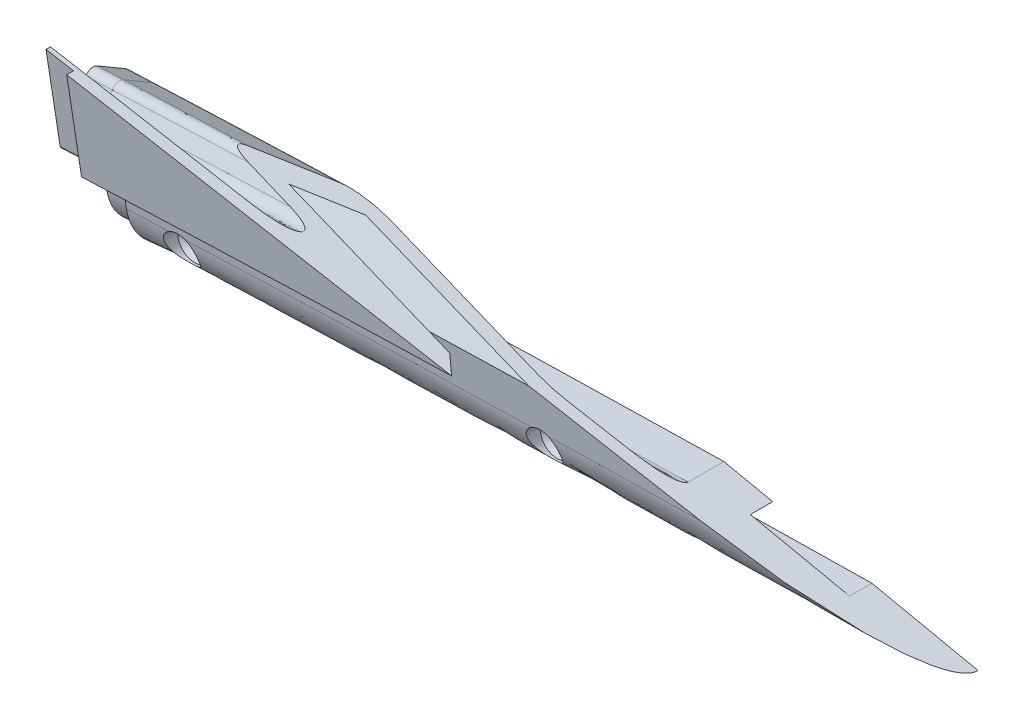
from build123d import *


with BuildPart() as part:
    # Sweep3: sweep along a path in Sketch3
    with BuildLine(Plane.XY.offset(101.6)) as sweep3_path:
        ThreePointArc((622.103936151, -83.199836272), (0, -43.636564626), (-622.103936151, -83.199836272))
    # Sketch4 → Sweep3 (sweep)
    with BuildSketch(Plane(origin=(-117.330566703, 4.430423936, 1117.6), x_dir=(0, 0, -1), z_dir=(0.9994536405585157, 0.03305178322465143, 0))):
        with BuildLine():
            Line((991.529482971, -5.453775083), (988.971801376, -5.453775083))
            Line((988.971801376, -5.453775083), (993.32506615, -42.283775083))
            Line((993.32506615, -42.283775083), (996.794703229, -41.354088728))
            Line((996.794703229, -41.354088728), (1002.763703229, -31.015013775))
            Line((1002.763703229, -31.015013775), (1007.999, -34.037749136))
            Line((1007.999, -34.037749136), (1002.03, -44.376824659))
            Line((1002.03, -44.376824659), (1003.077032208, -53.235049058))
            ThreePointArc((1003.077032208, -53.235049058), (1007.29752688, -61.276835992), (1015.8095, -64.443731312))
            Line((1015.8095, -64.443731312), (1015.8095, -59.12218153))
            Line((1015.8095, -59.12218153), (1010.7295, -59.12218153))
            Line((1010.7295, -59.12218153), (1010.7295, -54.041969025))
            Line((1010.7295, -54.041969025), (1015.8095, -54.041969025))
            Line((1015.8095, -54.041969025), (1015.8095, -51.501969025))
            Line((1015.8095, -51.501969025), (1007.687322123, -51.501969025))
            ThreePointArc((1007.687322123, -51.501969025), (1005.99997215, -50.860507955), (1005.164881483, -49.260118685))
            Line((1005.164881483, -49.260118685), (1004.750455768, -45.75394576))
            ThreePointArc((1004.750455768, -45.75394576), (1004.7850335, -44.943801809), (1005.073167189, -44.18583887))
            Line((1005.073167189, -44.18583887), (1010.516206197, -34.757795418))
            ThreePointArc((1010.516206197, -34.757795418), (1010.706497969, -33.312277166), (1009.818941274, -32.155567572))
            Line((1009.818941274, -32.155567572), (1003.483804566, -28.49781089))
            ThreePointArc((1003.483804566, -28.49781089), (1002.038222268, -28.307482122), (1000.881475684, -29.195102853))
            Line((1000.881475684, -29.195102853), (999.272416391, -31.982200293))
            ThreePointArc((999.272416391, -31.982200293), (996.560692883, -33.200105913), (994.550246564, -31.010392672))
            Line((994.550246564, -31.010392672), (991.529482971, -5.453775083))
        make_face()
    sweep(path=sweep3_path.line)

    # SurfaceCut1
    split(bisect_by=Plane(origin=(-211.442164364, -9.040193423, 0), x_dir=(0.04271589869142412, -0.9990872594518379, 0), z_dir=(-0.9990872594518379, -0.04271589869142412, 0)), keep=Keep.BOTTOM)

    # SurfaceCut2
    split(bisect_by=Plane(origin=(-22.670567211, -0.103737371, 0), x_dir=(-0.004575813400742646, 0.9999895309110599, 0), z_dir=(0.99998953091106, 0.004575813400742646, 0)), keep=Keep.BOTTOM)

    # Sketch8 → Cut-Revolve1 (revolve, cut)
    with BuildSketch(Plane(origin=(-117.056038996, -3.871025798, 0), x_dir=(0, 0, -1), z_dir=(0.9994536405585157, 0.03305178322465143, 0)), mode=Mode.PRIVATE) as cut_revolve1_sk:
        Polygon((-119.5705, -48.27608749), (-106.8705, -48.27608749), (-106.8705, -46.37108749), (-108.7755, -46.37108749), (-110.6805, -44.46608749), (-119.5705, -44.46608749), align=None)
    cut_revolve1 = revolve(cut_revolve1_sk.sketch.rotate(Axis((-115.460428217, -52.120737191, 119.5705), (0, 0, -1)), 91.894072645), axis=Axis((-115.460428217, -52.120737191, 119.5705), (0, 0, -1)), mode=Mode.SUBTRACT)

    # Sketch-Pattern1: Cut-Revolve1 at 2 more places
    with Locations((82.543476, 1.248991, 0), (-82.510753, -2.638363, 0)):
        add(cut_revolve1, mode=Mode.SUBTRACT)

    # Sweep4: sweep along a path in Sketch12
    with BuildLine(Plane(origin=(0, 0, 101.7905), x_dir=(-1, 0, 0), z_dir=(0, 0, -1))) as sweep4_path:
        ThreePointArc((22.461775047, -45.732778631), (19.477278647, -45.720029285), (16.492775047, -45.709094497))
    # Sketch11 → Sweep4 (sweep)
    with BuildSketch(Plane(origin=(-22.670567211, -0.103737371, 0), x_dir=(0, 0, -1), z_dir=(0.9999895309110599, 0.004575813400742645, 0))):
        with BuildLine():
            Line((-127.477241199, 0.416616241), (-123.294888708, -34.965832659))
            Line((-123.294888708, -34.965832659), (-121.558436986, -34.500572786))
            Line((-121.558436986, -34.500572786), (-115.572163807, -24.132043494))
            ThreePointArc((-115.572163807, -24.132043494), (-115.18658777, -23.836180594), (-114.704737676, -23.899617362))
            Line((-114.704737676, -23.899617362), (-108.589559095, -27.430217362))
            ThreePointArc((-108.589559095, -27.430217362), (-108.293696195, -27.8157934), (-108.357132963, -28.297643494))
            Line((-108.357132963, -28.297643494), (-114.390345193, -38.747473608))
            Line((-114.390345193, -38.747473608), (-113.38787021, -47.228347431))
            add(Edge.make_bspline(
                [(-113.38787021, -47.228347431), (-113.304795542, -47.931153716), (-113.005394664, -49.331088938), (-111.931567303, -51.921905104), (-109.715936846, -54.745328052), (-106.035083238, -56.946179963), (-103.201893406, -57.44100982), (-101.801323322, -57.427746915)],
                knots=[0, 0, 0, 0, 0.125, 0.25, 0.5, 0.75, 1, 1, 1, 1], degree=3))
            Line((-101.801323322, -57.427746915), (-101.7905, -57.427746915))
            Line((-101.7905, -57.427746915), (-101.7905, -58.570695669))
            add(Edge.make_bspline(
                [(-114.522967792, -47.362520754), (-114.477136038, -47.750254403), (-114.413580033, -48.134868747), (-114.251122313, -48.897876915), (-114.152305696, -49.275250489), (-113.807619255, -50.383084428), (-113.512952594, -51.094253598), (-112.794349261, -52.462021573), (-112.366195112, -53.121992394), (-111.411403795, -54.334514945), (-110.882225451, -54.893793968), (-110.009875034, -55.661414508), (-109.70425095, -55.906443165), (-109.076570448, -56.363840109), (-108.75418736, -56.576773283), (-107.762018779, -57.169401136), (-107.067422067, -57.503308187), (-105.974437358, -57.909885857), (-105.601773783, -58.029259911), (-104.85459633, -58.231444087), (-104.478193263, -58.315009286), (-103.340677537, -58.513974287), (-102.571330027, -58.578089855), (-101.7905, -58.570695669)],
                knots=[0, 0, 0, 0, 0.0625, 0.0625, 0.125, 0.125, 0.25, 0.25, 0.375, 0.375, 0.5, 0.5, 0.5625, 0.5625, 0.625, 0.625, 0.75, 0.75, 0.8125, 0.8125, 0.875, 0.875, 1, 1, 1, 1], degree=3))
            Line((-114.522967792, -47.362520754), (-115.57, -38.504695669))
            Line((-115.57, -38.504695669), (-109.601, -28.166084399))
            Line((-109.601, -28.166084399), (-114.836296771, -25.143484399))
            Line((-114.836296771, -25.143484399), (-120.805296771, -35.482095669))
            Line((-120.805296771, -35.482095669), (-124.27493385, -36.411740234))
            Line((-124.27493385, -36.411740234), (-128.628198624, 0.416616241))
            Line((-128.628198624, 0.416616241), (-127.477241199, 0.416616241))
        make_face()
    sweep(path=sweep4_path.line)

    # Sweep5: sweep along a path in Sketch16
    with BuildLine(Plane(origin=(0, 0, 101.7905), x_dir=(-1, 0, 0), z_dir=(0, 0, -1))) as sweep5_path:
        ThreePointArc((215.647406705, -50.42045008), (212.665748146, -50.290245196), (209.684010975, -50.161853153))
    # Sketch15 → Sweep5 (sweep)
    with BuildSketch(Plane(origin=(-211.442164364, -9.040193423, 0), x_dir=(0, 0, 1), z_dir=(-0.9990872594518379, -0.04271589869142412, 0))):
        with BuildLine():
            Line((113.00950435, -42.713331456), (113.97237291, -34.567525415))
            ThreePointArc((113.97237291, -34.567525415), (113.963727961, -34.364981701), (113.891689273, -34.175484686))
            Line((113.891689273, -34.175484686), (107.519177285, -23.137970149))
            Line((107.519177285, -23.137970149), (115.394119486, -18.591370149))
            Line((115.394119486, -18.591370149), (121.677968823, -29.475316467))
            ThreePointArc((121.677968823, -29.475316467), (121.841334284, -29.661598015), (122.06355177, -29.771181218))
            Line((122.06355177, -29.771181218), (122.259394286, -29.823654698))
            ThreePointArc((122.259394286, -29.823654698), (122.780015415, -29.735923875), (123.054347243, -29.284830643))
            Line((123.054347243, -29.284830643), (127.093588723, 4.886907775))
            Line((127.093588723, 4.886907775), (126.070517029, 4.886907775))
            Line((126.070517029, 4.886907775), (123.049753436, -20.668571968))
            add(Edge.make_bspline(
                [(123.049753436, -20.668571968), (123.018406598, -20.933764287), (122.944898871, -21.192703381), (122.72486191, -21.671025374), (122.574983618, -21.89613649), (122.218479429, -22.283693321), (122.006878086, -22.451668909), (121.662818096, -22.646204147), (121.543504304, -22.701961436), (121.295473201, -22.795007288), (121.166493424, -22.832124521), (120.907997451, -22.885096572), (120.777385583, -22.901432856), (120.51342226, -22.913717924), (120.37910716, -22.909438417), (120.116311005, -22.880334184), (119.986998098, -22.855691982), (119.732512188, -22.786374688), (119.606266969, -22.741161694), (119.243601748, -22.578043456), (119.021351761, -22.432970621), (118.626712377, -22.076251458), (118.461102845, -21.871598209), (118.327583609, -21.640336089)],
                knots=[0, 0, 0, 0, 0.125, 0.125, 0.25, 0.25, 0.375, 0.375, 0.4375, 0.4375, 0.5, 0.5, 0.5625, 0.5625, 0.625, 0.625, 0.6875, 0.6875, 0.75, 0.75, 0.875, 0.875, 1, 1, 1, 1], degree=3))
            Line((118.327583609, -21.640336089), (116.718524316, -18.853363359))
            ThreePointArc((116.718524316, -18.853363359), (115.561765682, -17.965779092), (114.116195434, -18.156102576))
            Line((114.116195434, -18.156102576), (107.781058726, -21.813695606))
            ThreePointArc((107.781058726, -21.813695606), (106.893505265, -22.97034131), (107.083793803, -24.415806877))
            Line((107.083793803, -24.415806877), (112.526832811, -33.84342694))
            ThreePointArc((112.526832811, -33.84342694), (112.814966033, -34.601353512), (112.849544232, -35.411463252))
            Line((112.849544232, -35.411463252), (112.435118517, -38.917478209))
            ThreePointArc((112.435118517, -38.917478209), (111.600006373, -40.51781438), (109.912677877, -41.159227425))
            Line((109.912677877, -41.159227425), (101.7905, -41.159227425))
            Line((101.7905, -41.159227425), (101.7905, -43.699112741))
            Line((101.7905, -43.699112741), (106.8705, -43.699112741))
            Line((106.8705, -43.699112741), (106.8705, -48.779095512))
            Line((106.8705, -48.779095512), (101.7905, -48.779095512))
            Line((101.7905, -48.779095512), (101.7905, -52.576472462))
            Line((101.7905, -52.576472462), (101.804931097, -52.576472462))
            add(Edge.make_bspline(
                [(101.804931097, -52.576472462), (102.489279498, -52.582953001), (103.868868527, -52.467414443), (106.485766193, -51.75509811), (109.465837716, -49.976138537), (112.028433947, -46.715360308), (112.850511097, -44.058404026), (113.00950435, -42.713331456)],
                knots=[0, 0, 0, 0, 0.125, 0.25, 0.5, 0.75, 1, 1, 1, 1], degree=3))
        make_face()
    sweep(path=sweep5_path.line)

    # SurfaceCut3
    split(bisect_by=Plane(origin=(-13.144389772, -61.979827336, 0), x_dir=(-0.9782432432437956, 0.2074612181779046, 0), z_dir=(-0.20746121817790464, -0.9782432432437957, 0)), keep=Keep.TOP)


solid = part.part
